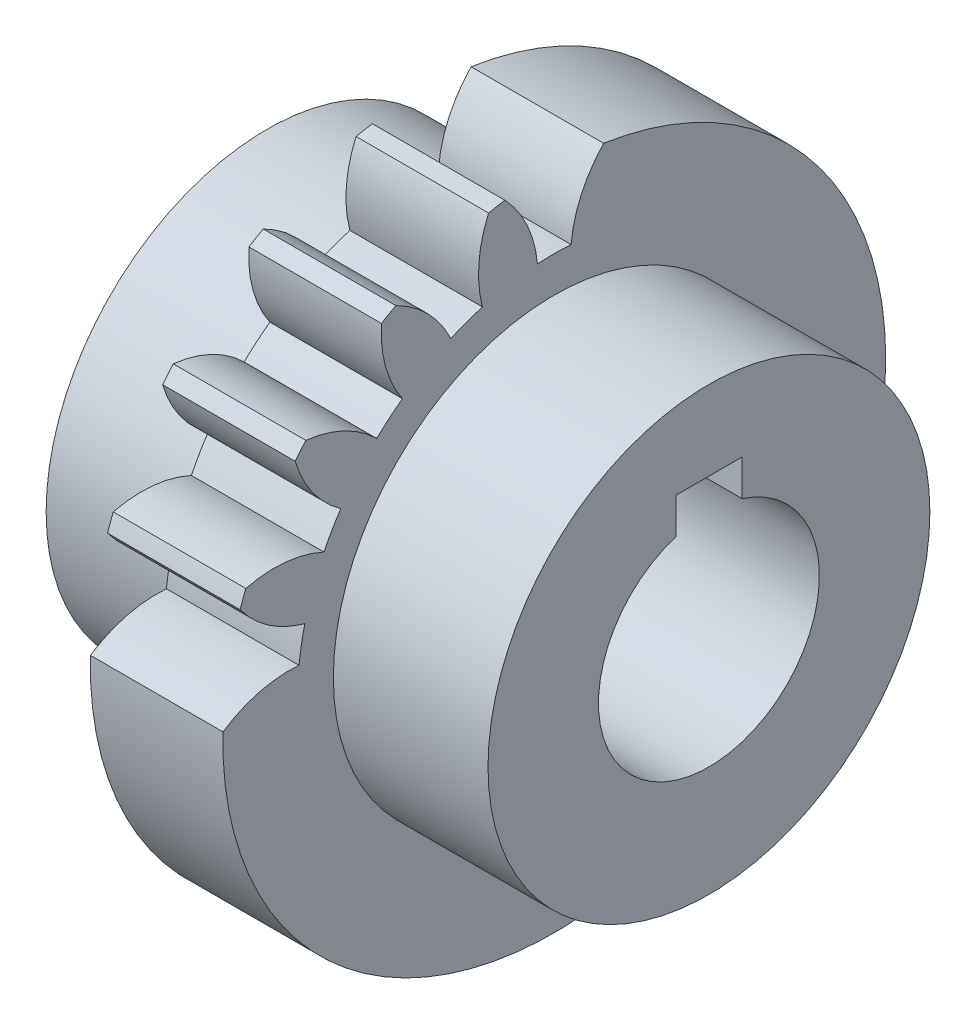
from build123d import *

# Parameters (mm, degrees)
BASPROSKE_W       = 12
BASPROSKE_H       = 30
TOOTHCUT_DEPTH    = 45.09081537
TEETHCUTS_COUNT   = 5
TEETHCUTS_ANGLE   = 80
HUBNEABOTSKE_R    = 20
HUBNEARBOTH_DEPTH = 14.0000254
HUBFAR_START      = 14.0000254
HUBFARSKE_R       = 20
HUBFAR_DEPTH      = 14.0000254
BORSKE_R          = 10
BORE_DEPTH        = 40.0000508
KEYSKE_W          = 6
KEYSKE_H          = 12.8
KEYWAY_DEPTH      = 40.0000508


with BuildPart() as part:
    # BasProSke → Base-Revolve (revolve)
    with BuildSketch(Plane(origin=(0, 0, 0), x_dir=(1, 0, 0), z_dir=(0, 1, 0))):
        with Locations((6, 15)):
            Rectangle(BASPROSKE_W, BASPROSKE_H)
    revolve(axis=Axis((-10, 0, 0), (1, 0, 0)))

    # TooCutSke → ToothCut (cut, through all)
    with BuildSketch(Plane(origin=(0, 0, 0), x_dir=(0, 0, -1), z_dir=(1, 0, 0))):
        with BuildLine():
            ThreePointArc((1.5215504, 23.199156997), (0, 23.249), (-1.5215504, 23.199156997))
            ThreePointArc((-1.5215504, 23.199156997), (-2.453834427, 26.695678065), (-4.48878157, 29.687968694))
            ThreePointArc((-4.48878157, 29.687968694), (0, 30.0254), (4.48878157, 29.687968694))
            ThreePointArc((4.48878157, 29.687968694), (2.453834427, 26.695678065), (1.5215504, 23.199156997))
        make_face()
    toothcut = extrude(amount=TOOTHCUT_DEPTH, mode=Mode.SUBTRACT)

    # TeethCuts: ToothCut ×5 about axis
    teethcuts_axis = Axis((-10, 0, 0), (1, 0, 0))
    for i in range(1, TEETHCUTS_COUNT):
        add(toothcut.rotate(teethcuts_axis, i * TEETHCUTS_ANGLE / (TEETHCUTS_COUNT - 1)), mode=Mode.SUBTRACT)

    # HubNeaBotSke → HubNearBoth (add)
    with BuildSketch(Plane.ZY):
        Circle(HUBNEABOTSKE_R)
    extrude(amount=HUBNEARBOTH_DEPTH)

    # HubFarSke → HubFar (add)
    with BuildSketch(Plane(origin=(12, 0, 0), x_dir=(0, 0, -1), z_dir=(1, 0, 0)).offset(HUBFAR_START)):
        Circle(HUBFARSKE_R)
    extrude(amount=-HUBFAR_DEPTH)

    # BorSke → Bore (cut, symmetric)
    with BuildSketch(Plane(origin=(0, 0, 0), x_dir=(0, 0, -1), z_dir=(1, 0, 0))):
        Circle(BORSKE_R)
    extrude(amount=BORE_DEPTH, both=True, mode=Mode.SUBTRACT)

    # KeySke → Keyway (cut, symmetric)
    with BuildSketch(Plane(origin=(0, 0, 0), x_dir=(0, 0, -1), z_dir=(1, 0, 0))):
        with Locations((0, 6.4)):
            Rectangle(KEYSKE_W, KEYSKE_H)
    extrude(amount=KEYWAY_DEPTH, both=True, mode=Mode.SUBTRACT)


solid = part.part
